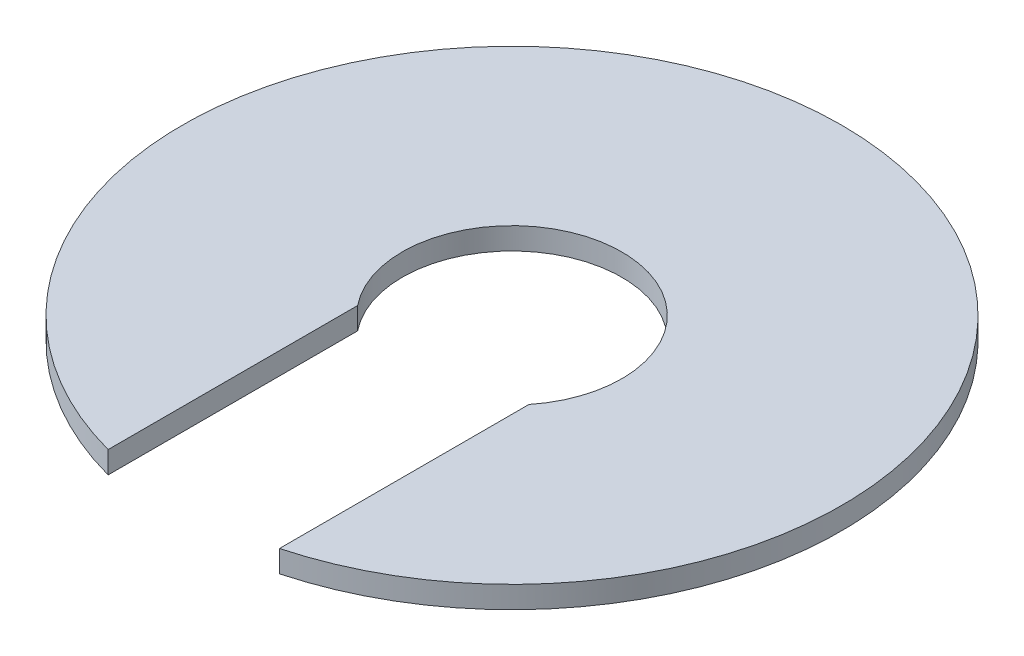
from build123d import *

# Parameters (mm, degrees)
BOSS_EXTRUDE1_DEPTH = 0.254


with BuildPart() as part:
    # Sketch1 → Boss-Extrude1 (new body)
    with BuildSketch(Plane(origin=(0, 0, 0), x_dir=(1, 0, 0), z_dir=(0, 1, 0))):
        with BuildLine():
            Line((-0.990450861, -3.679008982), (-0.990450861, -0.79492584))
            ThreePointArc((-0.990450861, -0.79492584), (0, 1.27), (0.990450861, -0.79492584))
            Line((0.990450861, -0.79492584), (0.990450861, -3.679008982))
            ThreePointArc((0.990450861, -3.679008982), (0, 3.81), (-0.990450861, -3.679008982))
        make_face()
    extrude(amount=BOSS_EXTRUDE1_DEPTH)


solid = part.part
